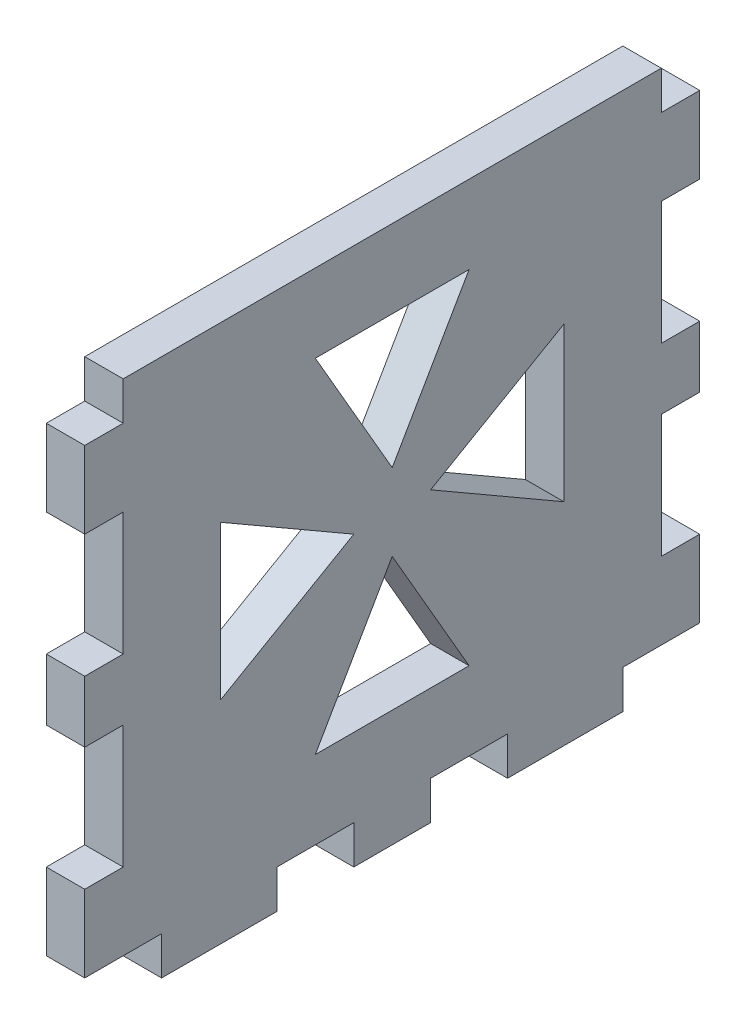
from build123d import *

# Parameters (mm, degrees)
BOSS_EXTRUDE1_DEPTH = 6.35
CUT_EXTRUDE1_DEPTH  = 6.35


with BuildPart() as part:
    # Sketch1 → Boss-Extrude1 (new body)
    with BuildSketch(Plane(origin=(0, 0, 0), x_dir=(0, 0, -1), z_dir=(1, 0, 0))):
        Polygon((44.45, 0), (57.15, 0), (57.15, 6.35), (69.85, 6.35), (69.85, 0), (88.9, 0), (88.9, 6.35), (101.6, 6.35), (101.6, 19.05), (95.25, 19.05), (95.25, 39.37), (101.6, 39.37), (101.6, 49.53), (95.25, 49.53), (95.25, 69.85), (101.6, 69.85), (101.6, 82.55), (95.25, 82.55), (95.25, 88.9), (6.35, 88.9), (6.35, 82.55), (0, 82.55), (0, 69.85), (6.35, 69.85), (6.35, 49.53), (0, 49.53), (0, 39.37), (6.35, 39.37), (6.35, 19.05), (0, 19.05), (0, 6.35), (12.7, 6.35), (12.7, 0), (31.75, 0), (31.75, 6.35), (44.45, 6.35), align=None)
    extrude(amount=BOSS_EXTRUDE1_DEPTH)

    # Sketch2 → Cut-Extrude1 (cut)
    with BuildSketch(Plane(origin=(6.35, 0, 0), x_dir=(0, 0, -1), z_dir=(1, 0, 0))):
        Polygon((44.45, 47.625), (22.452954744, 60.325), (22.452954744, 34.925), align=None)
        Polygon((50.8, 53.975), (63.5, 75.972045256), (38.1, 75.972045256), align=None)
        Polygon((57.15, 47.625), (79.147045256, 34.925), (79.147045256, 60.325), align=None)
        Polygon((50.8, 41.275), (38.1, 19.277954744), (63.5, 19.277954744), align=None)
    extrude(amount=-CUT_EXTRUDE1_DEPTH, mode=Mode.SUBTRACT)


solid = part.part
